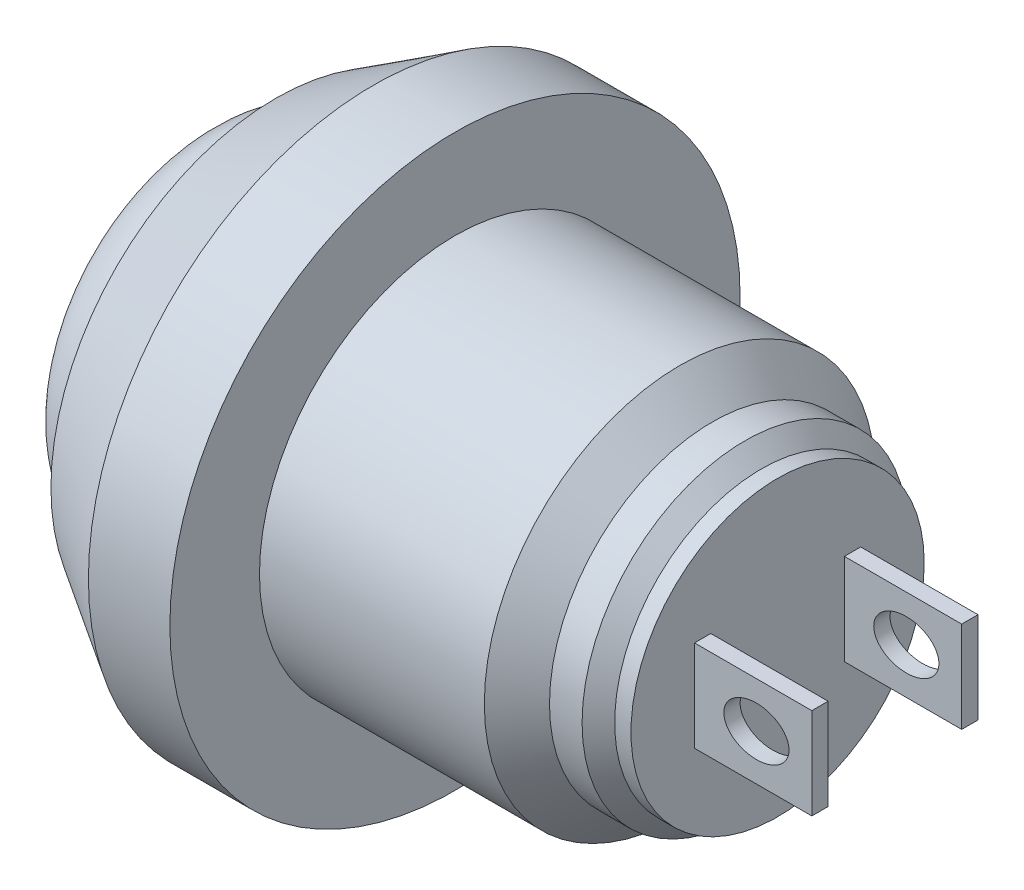
from build123d import *

# Parameters (mm, degrees)
SKETCH3_W           = 3.6
SKETCH3_H           = 2.8
SKETCH3_RX          = 1
SKETCH3_RY          = 0.75
BOSS_EXTRUDE1_DEPTH = 0.25


with BuildPart() as part:
    # Sketch2 → Revolve1 (revolve)
    with BuildSketch(Plane(origin=(0, 0, 0), x_dir=(1, 0, 0), z_dir=(0, 1, 0))):
        with BuildLine():
            Line((0, 8.75), (-2.5, 8.75))
            Line((-2.5, 8.75), (-5.5, 6.9))
            Line((-5.5, 6.9), (-5.5, 5.9))
            add(Edge.make_bspline(
                [(-5.5, 5.9), (-6.436492627, 5.9), (-8.1, 5.494365828), (-8.1, 3)],
                knots=[0, 0, 0, 0, 1, 1, 1, 1], degree=3))
            Line((-8.1, 3), (-8.1, 0))
            Line((-8.1, 0), (0, 0))
            Line((0, 0), (9.9, 0))
            Line((9.9, 0), (9.9, 4.5))
            Line((9.9, 4.5), (9.4, 4.5))
            Line((9.4, 4.5), (8.9, 5))
            Line((8.9, 5), (7.9, 5))
            Line((7.9, 5), (6.9, 6))
            Line((6.9, 6), (0, 6))
            Line((0, 6), (0, 8.75))
        make_face()
    revolve(axis=Axis((0, 0, 0), (-1, 0, 0)))

    # Sketch3 → Boss-Extrude1 (add, symmetric)
    with BuildSketch(Plane.XY.offset(2.3)):
        with Locations((11.7, 0)):
            Rectangle(SKETCH3_W, SKETCH3_H)
        with Locations((11.8, 0)):
            Ellipse(SKETCH3_RX, SKETCH3_RY, mode=Mode.SUBTRACT)
    boss_extrude1 = extrude(amount=BOSS_EXTRUDE1_DEPTH, both=True)

    # Mirror1: Boss-Extrude1 across plane
    add(boss_extrude1.mirror(Plane.XY))


solid = part.part
